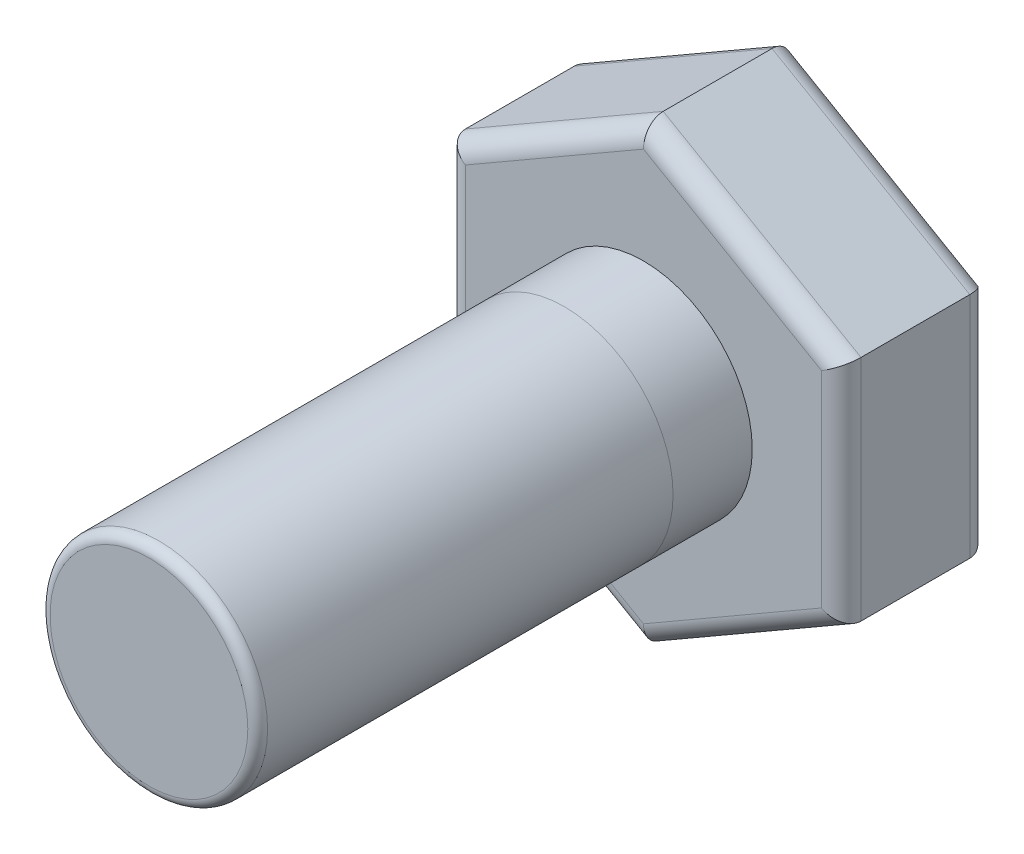
from build123d import *

# Parameters (mm, degrees)
EXTRUDE_414_DEPTH = 15
SKETCH_2_R        = 11
EXTRUDE_1_DEPTH   = 8
FILLET_3_R        = 2
SKETCH_3_R        = 10.995
EXTRUDE_1_2_DEPTH = 42
FILLET_4_R        = 1


with BuildPart() as part:
    # 草图1 → Extrude 414 (new body)
    with BuildSketch(Plane.XY):
        Polygon((20, 11.547005384), (0, 23.094010768), (-20, 11.547005384), (-20, -11.547005384), (0, -23.094010768), (20, -11.547005384), align=None)
    extrude(amount=EXTRUDE_414_DEPTH)

    # 草图2 → Extrude 1 (add)
    with BuildSketch(Plane.XY.offset(15)):
        Circle(SKETCH_2_R)
    extrude(amount=EXTRUDE_1_DEPTH)

    # 圆角3
    fillet_3_edges = [part.edges().sort_by_distance(p)[0] for p in [
        (-10, 17.320508076, 15),
        (-20, 0, 15),
        (-10, -17.320508076, 15),
        (10, -17.320508076, 15),
        (20, 0, 15),
        (10, -17.320508076, 0),
        (-10, -17.320508076, 0),
        (-20, 0, 0),
        (10, 17.320508076, 15),
        (-10, 17.320508076, 0),
        (10, 17.320508076, 0),
        (20, 0, 0),
    ]]
    fillet(fillet_3_edges, radius=FILLET_3_R)

    # 草图3 → Extrude 1 2 (add)
    with BuildSketch(Plane.XY.offset(23)):
        Circle(SKETCH_3_R)
    extrude(amount=EXTRUDE_1_2_DEPTH)

    # 圆角4
    fillet_4_edges = [part.edges().sort_by_distance(p)[0] for p in [
        (-10.995, 0, 65),
    ]]
    fillet(fillet_4_edges, radius=FILLET_4_R)


solid = part.part
